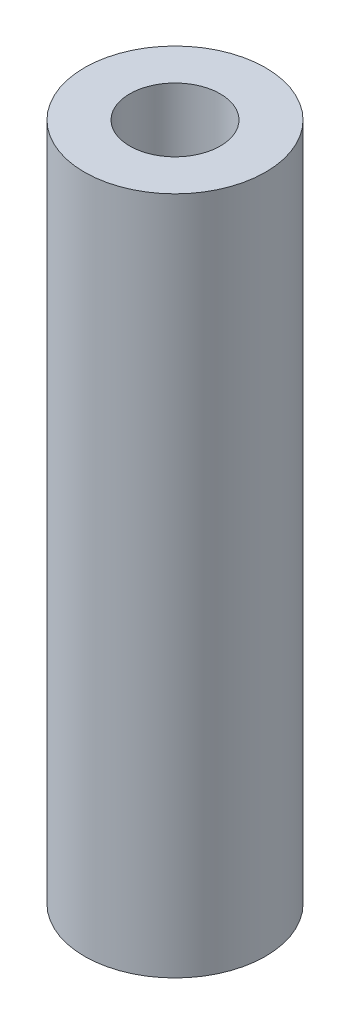
from build123d import *

# Parameters (mm, degrees)
SKETCH1_R           = 5.08
SKETCH1_R_2         = 2.54
BOSS_EXTRUDE1_DEPTH = 38.1


with BuildPart() as part:
    # Sketch1 → Boss-Extrude1 (new body)
    with BuildSketch(Plane(origin=(0, 0, 0), x_dir=(1, 0, 0), z_dir=(0, 1, 0))):
        with Locations(Location((0, 0, 0), (0, 0, 90))):
            Circle(SKETCH1_R)
        with Locations(Location((0, 0, 0), (0, 0, 90))):
            Circle(SKETCH1_R_2, mode=Mode.SUBTRACT)
    extrude(amount=BOSS_EXTRUDE1_DEPTH)


solid = part.part
